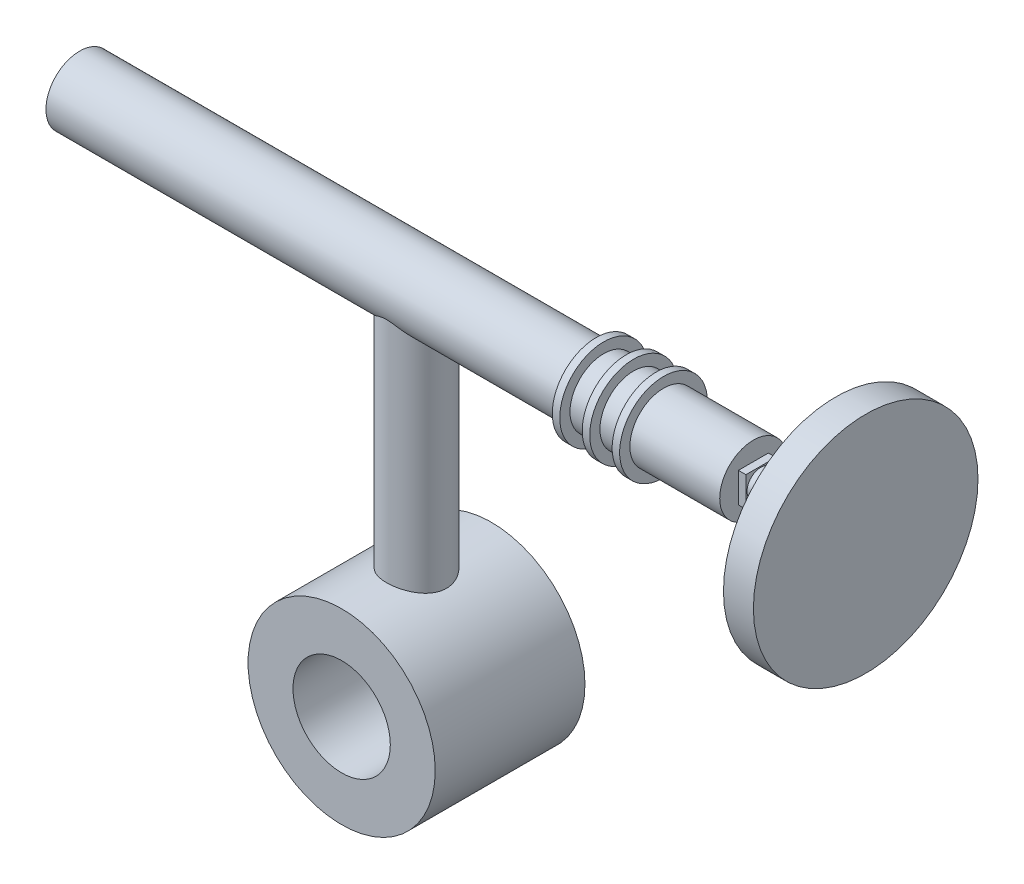
from build123d import *

# Parameters (mm, degrees)
SKETCH2_R           = 6.25
EXTRUDE1_DEPTH      = 5
SKETCH3_R           = 2
EXTRUDE2_DEPTH      = 22.5
EXTRUDE3_DEPTH      = 22.5
EXTRUDE3_DEPTH_BACK = 22.5
SKETCH4_R           = 2.25
SKETCH5_R           = 2.933820517
EXTRUDE4_DEPTH      = 0.5
LPATTERN1_COUNT     = 3
LPATTERN1_PITCH     = 2
SKETCH9_W           = 2
SKETCH9_H           = 2
EXTRUDE6_DEPTH      = 0.5
SKETCH7_R           = 3.25
CUT_EXTRUDE1_DEPTH  = 36.719451677
SKETCH6_R           = 0.925
EXTRUDE7_DEPTH      = 5
SKETCH10_R          = 7.5
EXTRUDE8_DEPTH      = 2


with BuildPart() as part:
    # Sketch2 → Extrude1 (new, symmetric)
    with BuildSketch(Plane.XY):
        Circle(SKETCH2_R)
    extrude(amount=EXTRUDE1_DEPTH, both=True)

    # Sketch3 → Extrude2 (add)
    with BuildSketch(Plane(origin=(0, 0, 0), x_dir=(-1, 0, 0), z_dir=(0, 1, 0))):
        Circle(SKETCH3_R)
    extrude(amount=EXTRUDE2_DEPTH)

    # Sketch4 → Extrude3 (add, two sides: drawn at the far end of the back side and taken through both)
    with BuildSketch(Plane(origin=(0, 0, 0), x_dir=(0, 0, -1), z_dir=(1, 0, 0)).offset(-EXTRUDE3_DEPTH_BACK)):
        with Locations((0, 22.5)):
            Circle(SKETCH4_R)
    extrude(amount=EXTRUDE3_DEPTH + EXTRUDE3_DEPTH_BACK)

    # Sketch5 → Extrude4 (add)
    with BuildSketch(Plane(origin=(12, 0, 0), x_dir=(0, 0, -1), z_dir=(1, 0, 0))):
        with Locations((0, 22.5)):
            Circle(SKETCH5_R)
    extrude4 = extrude(amount=EXTRUDE4_DEPTH)

    # LPattern1: Extrude4 ×3
    with Locations(*[(i * LPATTERN1_PITCH, 0, 0) for i in range(1, LPATTERN1_COUNT)]):
        add(extrude4)

    # Sketch9 → Extrude6 (add)
    with BuildSketch(Plane(origin=(22.5, 0, 0), x_dir=(0, 0, -1), z_dir=(1, 0, 0))):
        with Locations((0, 22.5)):
            Rectangle(SKETCH9_W, SKETCH9_H)
    extrude(amount=EXTRUDE6_DEPTH)

    # Sketch7 → Cut-Extrude1 (cut, through all)
    with BuildSketch(Plane.XY.offset(5)):
        Circle(SKETCH7_R)
    extrude(amount=-CUT_EXTRUDE1_DEPTH, mode=Mode.SUBTRACT)

    # Sketch6 → Extrude7 (add)
    with BuildSketch(Plane(origin=(23, 0, 0), x_dir=(0, 0, -1), z_dir=(1, 0, 0))):
        with Locations((0, 22.5)):
            Circle(SKETCH6_R)
    extrude(amount=EXTRUDE7_DEPTH)

    # Sketch10 → Extrude8 (add)
    with BuildSketch(Plane(origin=(28, 0, 0), x_dir=(0, 0, -1), z_dir=(1, 0, 0))):
        with Locations((0, 22.5)):
            Circle(SKETCH10_R)
    extrude(amount=EXTRUDE8_DEPTH)


solid = part.part
